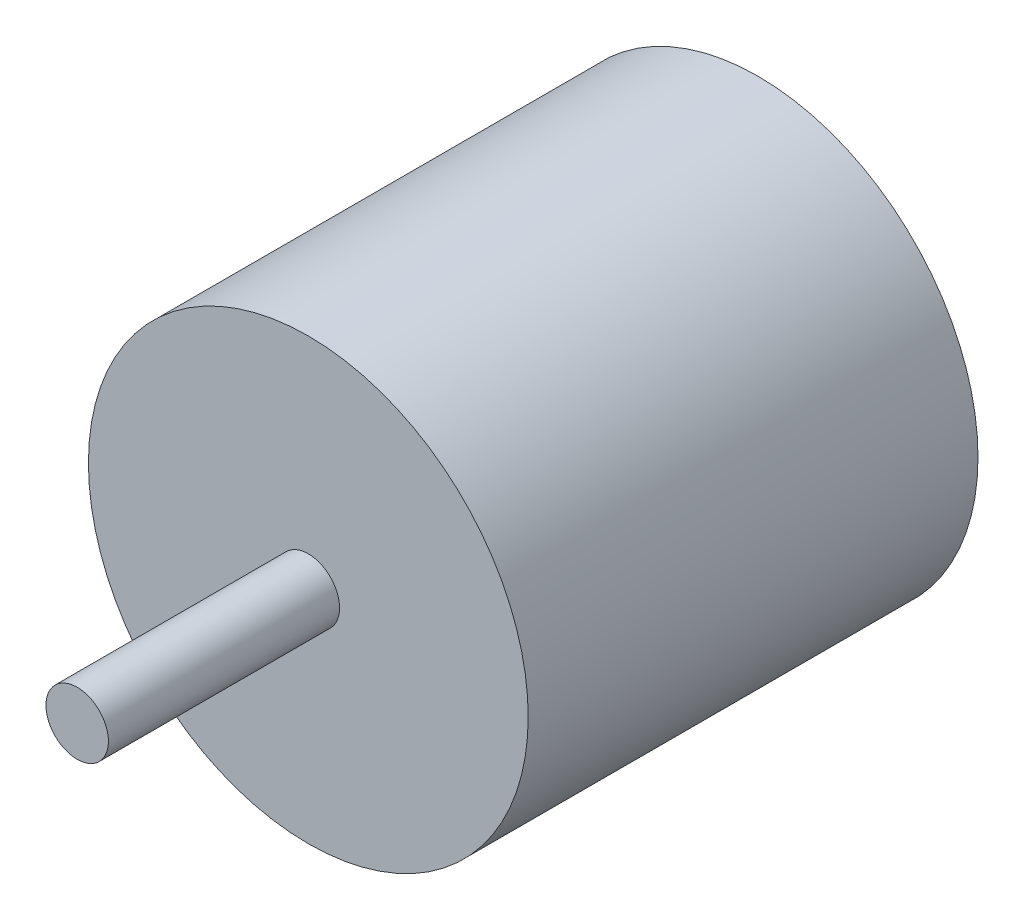
from build123d import *

# Parameters (mm, degrees)
SKETCH_1_R          = 17.6
SKETCH_1_R_2        = 2.5
EXTRUDE_1_DEPTH     = 36
EXTRUDE_START       = -2
SKETCH_1_4_R        = 2.5
EXTRUDE_2_DEPTH     = 2
EXTRUDE_START_2     = 36
SKETCH_1_5_R        = 2.5
EXTRUDE_3_DEPTH     = 18.5
SKETCH_2_R          = 1.5
CUT_EXTRUDE_1_DEPTH = 3


with BuildPart() as part:
    # Эскиз1 → Бобышка-Вытянуть1 (new body)
    # profile 1 of 2: a face of its own
    with BuildSketch(Plane.XY):
        Circle(SKETCH_1_R)
        Circle(SKETCH_1_R_2, mode=Mode.SUBTRACT)
    # profile 2 of 2: a face of its own
    with BuildSketch(Plane.XY):
        Circle(SKETCH_1_R_2)
    extrude(amount=EXTRUDE_1_DEPTH)

    # Эскиз1<4> → Бобышка-Вытянуть2 (add)
    with BuildSketch(Plane.XY.offset(EXTRUDE_START)):
        Circle(SKETCH_1_4_R)
    extrude(amount=EXTRUDE_2_DEPTH)

    # Эскиз1<5> → Бобышка-Вытянуть3 (add)
    with BuildSketch(Plane.XY.offset(EXTRUDE_START_2)):
        Circle(SKETCH_1_5_R)
    extrude(amount=EXTRUDE_3_DEPTH)

    # Эскиз2 → Вырез-Вытянуть1 (cut)
    with BuildSketch(Plane(origin=(0, 0, 0), x_dir=(-1, 0, 0), z_dir=(0, 0, -1))):
        with Locations((0, 12.5)):
            Circle(SKETCH_2_R)
        with Locations((-9.5, 0)):
            Circle(SKETCH_2_R)
        with Locations(Location((0, -12.5, 0), (0, 0, 180))):
            Circle(SKETCH_2_R)
        with Locations(Location((9.5, 0, 0), (0, 0, 180))):
            Circle(SKETCH_2_R)
    extrude(amount=-CUT_EXTRUDE_1_DEPTH, mode=Mode.SUBTRACT)


solid = part.part
